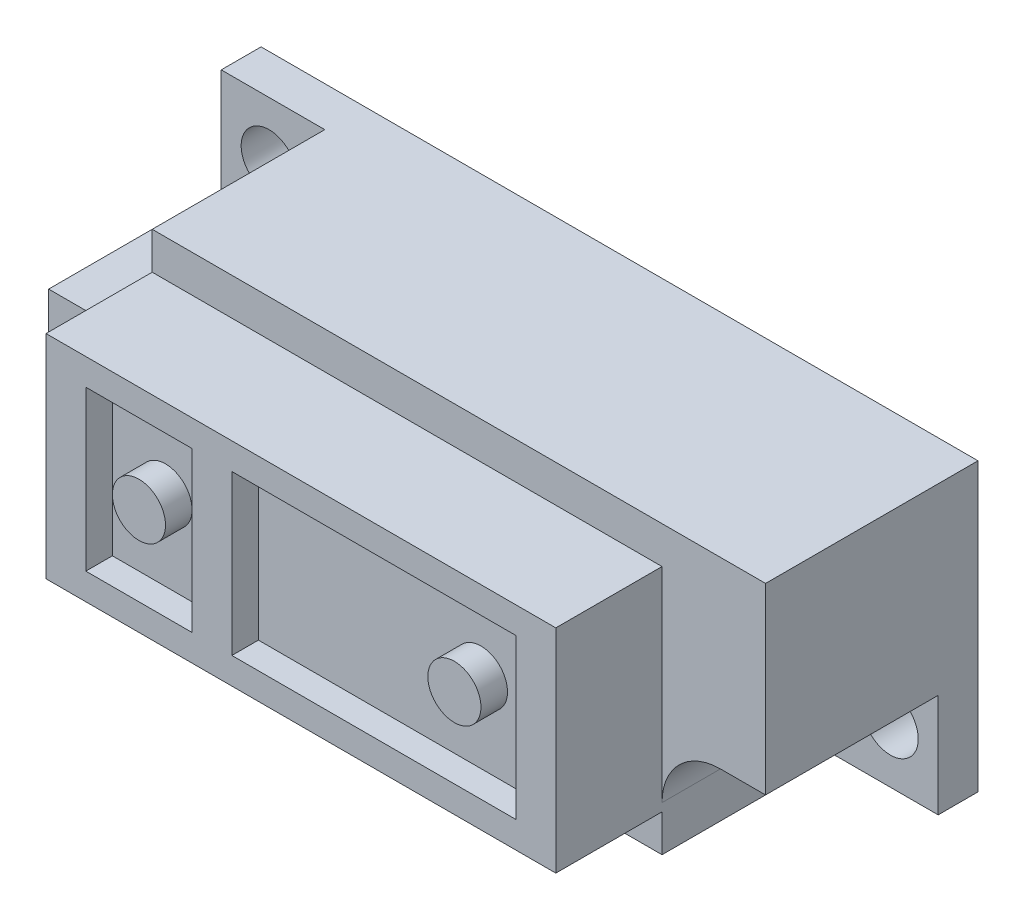
from build123d import *

# Parameters (mm, degrees)
ESQUISSE1_W             = 27
ESQUISSE1_H             = 10.8
BOSS_EXTRU_1_DEPTH      = 8
ESQUISSE2_R             = 1.05
ENL_V_MAT_EXTRU_1_DEPTH = 17.595481313
ESQUISSE3_W             = 19.2
ESQUISSE3_H             = 8
BOSS_EXTRU_2_DEPTH      = 4
ENL_V_MAT_EXTRU_2_DEPTH = 6.5
ESQUISSE5_W             = 4
ESQUISSE5_H             = 6
ESQUISSE5_R             = 1
ESQUISSE5_W_2           = 10.7
ENL_V_MAT_EXTRU_3_DEPTH = 1
ESQUISSE6_W             = 9.85
ESQUISSE6_H             = 1.4
ENL_V_MAT_EXTRU_4_DEPTH = 17.595481313
ESQUISSE7_W             = 6
ESQUISSE7_H             = 6
BOSS_EXTRU_3_DEPTH      = 3.5
ESQUISSE8_W             = 5
ESQUISSE8_H             = 2.5
ENL_V_MAT_EXTRU_5_DEPTH = 3.5
ENL_V_MAT_EXTRU_6_DEPTH = 2


with BuildPart() as part:
    # Esquisse1 → Boss.-Extru.1 (new body)
    with BuildSketch(Plane.XY):
        Rectangle(ESQUISSE1_W, ESQUISSE1_H)
    extrude(amount=BOSS_EXTRU_1_DEPTH)

    # Esquisse2 → Enlèv. mat.-Extru.1 (cut, through all)
    with BuildSketch(Plane.XY.offset(8)):
        with Locations((-11.7, 3.3)):
            Circle(ESQUISSE2_R)
        with Locations((11.7, -3.3)):
            Circle(ESQUISSE2_R)
    extrude(amount=-ENL_V_MAT_EXTRU_1_DEPTH, mode=Mode.SUBTRACT)

    # Esquisse3 → Boss.-Extru.2 (add)
    with BuildSketch(Plane.XY.offset(8)):
        Rectangle(ESQUISSE3_W, ESQUISSE3_H)
    extrude(amount=BOSS_EXTRU_2_DEPTH)

    # Esquisse4 → Enlèv. mat.-Extru.2 (cut)
    with BuildSketch(Plane.XY.offset(8)):
        with BuildLine():
            Line((-9.6, 3.7), (-9.6, 5.4))
            Line((-9.6, 5.4), (-13.5, 5.4))
            Line((-13.5, 5.4), (-13.5, 1.5))
            Line((-13.5, 1.5), (-11.8, 1.5))
            ThreePointArc((-11.8, 1.5), (-10.244365081, 2.144365081), (-9.6, 3.7))
        make_face()
        with BuildLine():
            Line((9.6, -5.4), (13.5, -5.4))
            Line((13.5, -5.4), (13.5, -1.5))
            Line((13.5, -1.5), (11.8, -1.5))
            ThreePointArc((11.8, -1.5), (10.244365081, -2.144365081), (9.6, -3.7))
            Line((9.6, -3.7), (9.6, -5.4))
        make_face()
    extrude(amount=-ENL_V_MAT_EXTRU_2_DEPTH, mode=Mode.SUBTRACT)

    # Esquisse5 → Enlèv. mat.-Extru.3 (cut)
    # profile 1 of 2: a face of its own
    with BuildSketch(Plane.XY.offset(12)):
        with Locations((-6.1, 0)):
            Rectangle(ESQUISSE5_W, ESQUISSE5_H)
        with Locations((-6.1, 0)):
            Circle(ESQUISSE5_R, mode=Mode.SUBTRACT)
    # profile 2 of 2: a face of its own
    with BuildSketch(Plane.XY.offset(12)):
        with Locations((2.75, 0)):
            Rectangle(ESQUISSE5_W_2, ESQUISSE5_H)
        with Locations((5.78, 0)):
            Circle(ESQUISSE5_R, mode=Mode.SUBTRACT)
    extrude(amount=-ENL_V_MAT_EXTRU_3_DEPTH, mode=Mode.SUBTRACT)

    # Esquisse6 → Enlèv. mat.-Extru.4 (cut, through all)
    with BuildSketch(Plane.XY.offset(8)):
        with Locations((-8.575, -4.7)):
            Rectangle(ESQUISSE6_W, ESQUISSE6_H)
    extrude(amount=-ENL_V_MAT_EXTRU_4_DEPTH, mode=Mode.SUBTRACT)

    # Esquisse7 → Boss.-Extru.3 (add)
    with BuildSketch(Plane.XZ.offset(4)):
        with Locations((-8.575, 0)):
            Rectangle(ESQUISSE7_W, ESQUISSE7_H)
    extrude(amount=BOSS_EXTRU_3_DEPTH)

    # Esquisse8 → Enlèv. mat.-Extru.5 (cut)
    with BuildSketch(Plane(origin=(0, 0, -3), x_dir=(-1, 0, 0), z_dir=(0, 0, -1))):
        with Locations((8.575, -5.75)):
            Rectangle(ESQUISSE8_W, ESQUISSE8_H)
    extrude(amount=-ENL_V_MAT_EXTRU_5_DEPTH, mode=Mode.SUBTRACT)

    # Esquisse9 → Enlèv. mat.-Extru.6 (cut)
    with BuildSketch(Plane(origin=(0, 0, 0), x_dir=(-1, 0, 0), z_dir=(0, 0, -1))):
        with BuildLine():
            Line((9, 4.9), (-13, 4.9))
            Line((-13, 4.9), (-13, -0.9))
            ThreePointArc((-13, -0.9), (-10.171572875, -2.071572875), (-9, -4.9))
            Line((-9, -4.9), (3.65, -4.9))
            Line((3.65, -4.9), (3.65, -4))
            Line((3.65, -4), (13, -4))
            Line((13, -4), (13, 0.9))
            ThreePointArc((13, 0.9), (10.171572875, 2.071572875), (9, 4.9))
        make_face()
    extrude(amount=-ENL_V_MAT_EXTRU_6_DEPTH, mode=Mode.SUBTRACT)


solid = part.part
